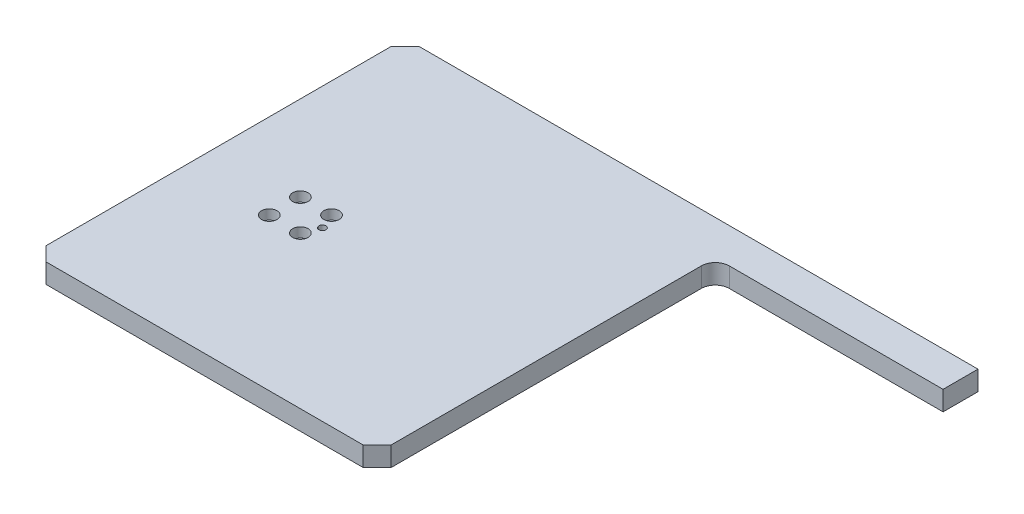
from build123d import *

# Parameters (mm, degrees)
BOSS_EXTRUDE1_DEPTH                                 = 14
SKETCH2_R                                           = 20
CUT_EXTRUDE1_DEPTH                                  = 2.28
CBORE_FOR_00_BINDING_HEAD_MACHINE_SCREW_D           = 4.499991
CBORE_FOR_00_BINDING_HEAD_MACHINE_SCREW_CBORE_D     = 11.0000034
CBORE_FOR_00_BINDING_HEAD_MACHINE_SCREW_CBORE_DEPTH = 7.0000114
SKETCH5_R                                           = 2.5
CUT_EXTRUDE2_DEPTH                                  = 369.713712791


with BuildPart() as part:
    # Sketch1 → Boss-Extrude1 (new body)
    with BuildSketch(Plane(origin=(0, 0, 0), x_dir=(1, 0, 0), z_dir=(0, 1, 0))):
        with BuildLine():
            Line((337.94, 147), (337.94, 122))
            Line((337.94, 122), (184.94, 122))
            ThreePointArc((184.94, 122), (177.868932188, 119.071067812), (174.94, 112))
            Line((174.94, 112), (174.94, -110))
            Line((174.94, -110), (164.94, -120))
            Line((164.94, -120), (-62.06, -120))
            Line((-62.06, -120), (-72.06, -110))
            Line((-72.06, -110), (-72.06, 137))
            Line((-72.06, 137), (-62.06, 147))
            Line((-62.06, 147), (337.94, 147))
        make_face()
    extrude(amount=BOSS_EXTRUDE1_DEPTH)

    # Sketch2 → Cut-Extrude1 (cut)
    with BuildSketch(Plane(origin=(0, 0, 0), x_dir=(1, 0, 0), z_dir=(0, 1, 0))):
        with Locations(Location((0, 0, 0), (0, 0, 90))):
            Circle(SKETCH2_R)
    extrude(amount=CUT_EXTRUDE1_DEPTH, mode=Mode.SUBTRACT)

    # CBORE for #00 Binding Head Machine Screw1 (through all)
    with Locations(Plane(origin=(0, 14, 0), x_dir=(-1, 0, 0), z_dir=(0, 1, 0))):
        with Locations((11.136931804, 11.136931804), (-11.136931804, 11.136931804), (-11.136931804, -11.136931804), (11.136931804, -11.136931804)):
            CounterBoreHole(CBORE_FOR_00_BINDING_HEAD_MACHINE_SCREW_D / 2, CBORE_FOR_00_BINDING_HEAD_MACHINE_SCREW_CBORE_D / 2, CBORE_FOR_00_BINDING_HEAD_MACHINE_SCREW_CBORE_DEPTH)

    # Sketch5 → Cut-Extrude2 (cut, through all)
    with BuildSketch(Plane(origin=(0, 2.28, 0), x_dir=(-1, 0, 0), z_dir=(0, -1, 0))):
        with Locations(Location((-15.75, 0, 0), (0, 0, 90))):
            Circle(SKETCH5_R)
    extrude(amount=-CUT_EXTRUDE2_DEPTH, mode=Mode.SUBTRACT)


solid = part.part
